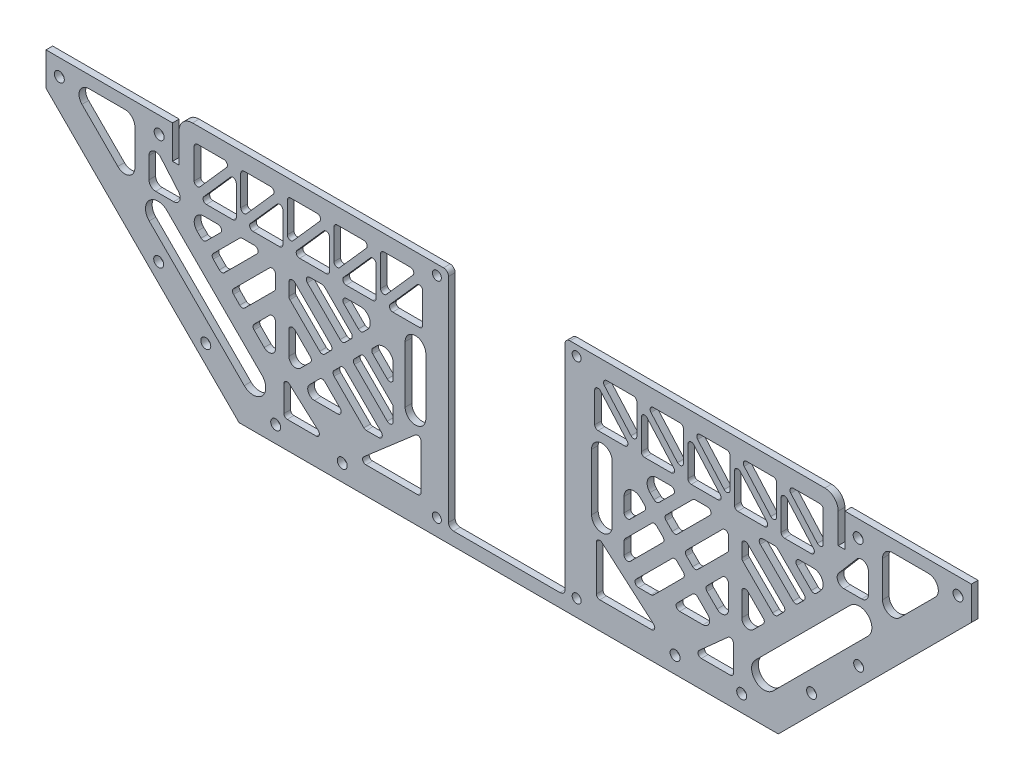
from build123d import *

# Parameters (mm, degrees)
SKETCH_1_R          = 1.5
EXTRUDE_1_DEPTH     = 2
SKETCH_2_R          = 1.5
CUT_EXTRUDE_1_DEPTH = 151.628682528
SKETCH_3_W          = 278
SKETCH_3_H          = 20
CUT_EXTRUDE_2_DEPTH = 151.628682528
EXTRUDE_2_DEPTH     = 2
SKETCH_8_W          = 35
SKETCH_8_H          = 3.344245934
SKETCH_8_R          = 1.35
CUT_EXTRUDE_6_DEPTH = 10
FILLET_2_R          = 1.5
CUT_EXTRUDE_7_DEPTH = 10


with BuildPart() as part:
    # 草图1 → 凸台-拉伸1 (new body)
    with BuildSketch(Plane.XY):
        Polygon((-101, 30), (-101, 0), (101, 0), (101, 30), (139, 30), (139, 0), (81, -58), (-81, -58), (-139, 0), (-139, 30), align=None)
        with Locations((-135, 25)):
            Circle(SKETCH_1_R, mode=Mode.SUBTRACT)
        with Locations((-105, 25)):
            Circle(SKETCH_1_R, mode=Mode.SUBTRACT)
        with Locations((-105, 5)):
            Circle(SKETCH_1_R, mode=Mode.SUBTRACT)
        with Locations((-135, 5)):
            Circle(SKETCH_1_R, mode=Mode.SUBTRACT)
        with Locations(Location((135, 5, 0), (0, 0, 180))):
            Circle(SKETCH_1_R, mode=Mode.SUBTRACT)
        with Locations(Location((105, 5, 0), (0, 0, 180))):
            Circle(SKETCH_1_R, mode=Mode.SUBTRACT)
        with Locations(Location((105, 25, 0), (0, 0, 180))):
            Circle(SKETCH_1_R, mode=Mode.SUBTRACT)
        with Locations(Location((135, 25, 0), (0, 0, 180))):
            Circle(SKETCH_1_R, mode=Mode.SUBTRACT)
        with Locations((-70, -53)):
            Circle(SKETCH_1_R, mode=Mode.SUBTRACT)
        with Locations((-50, -53)):
            Circle(SKETCH_1_R, mode=Mode.SUBTRACT)
        with Locations(Location((50, -53, 0), (0, 0, 180))):
            Circle(SKETCH_1_R, mode=Mode.SUBTRACT)
        with Locations(Location((70, -53, 0), (0, 0, 180))):
            Circle(SKETCH_1_R, mode=Mode.SUBTRACT)
    extrude(amount=EXTRUDE_1_DEPTH)

    # 草图2 → 切除-拉伸1 (cut, through all)
    with BuildSketch(Plane.XY.offset(2)):
        with Locations((-105.142135624, -28.201010127)):
            Circle(SKETCH_2_R)
        with Locations((-91, -42.343145751)):
            Circle(SKETCH_2_R)
        with Locations(Location((91, -42.343145751, 0), (0, 0, 180))):
            Circle(SKETCH_2_R)
        with Locations(Location((105.142135624, -28.201010127, 0), (0, 0, 180))):
            Circle(SKETCH_2_R)
    extrude(amount=-CUT_EXTRUDE_1_DEPTH, mode=Mode.SUBTRACT)

    # 草图3 → 切除-拉伸2 (cut, through all)
    with BuildSketch(Plane.XY.offset(2)):
        with Locations((0, 20)):
            Rectangle(SKETCH_3_W, SKETCH_3_H)
    extrude(amount=-CUT_EXTRUDE_2_DEPTH, mode=Mode.SUBTRACT)

    # 草图4 → 凸台-拉伸2 (add)
    with BuildSketch(Plane.XY.offset(2)):
        with BuildLine():
            Line((-99, 9), (-99, 0))
            Line((-99, 0), (0, 0))
            Line((0, 0), (0, 13))
            Line((0, 13), (-95, 13))
            ThreePointArc((-95, 13), (-97.828427125, 11.828427125), (-99, 9))
        make_face()
        with BuildLine():
            Line((0, 13), (0, 0))
            Line((0, 0), (99, 0))
            Line((99, 0), (99, 9))
            ThreePointArc((99, 9), (97.828427125, 11.828427125), (95, 13))
            Line((95, 13), (0, 13))
        make_face()
    extrude(amount=-EXTRUDE_2_DEPTH)

    # 草图8 → 切除-拉伸6 (cut)
    with BuildSketch(Plane.XY.offset(2)):
        Polygon((-18.072572425, 12.8), (-18.072572425, -54), (16.927427575, -54), (16.927427575, 12.8), (14.927427575, 12.8), (14.927427575, -43), (13.927427575, -43), (13.927427575, -31), (11.927427575, -31), (11.927427575, -43), (10.927427575, -43), (10.927427575, -31), (8.927427575, -31), (8.927427575, -43), (7.927427575, -43), (7.927427575, 12.8), (5.927427575, 12.8), (5.927427575, -43), (4.927427575, -43), (4.927427575, 12.8), (2.927427575, 12.8), (2.927427575, -43), (1.927427575, -43), (1.927427575, 12.8), (-0.072572425, 12.8), (-0.072572425, -43), (-1.072572425, -43), (-1.072572425, 12.8), (-3.072572425, 12.8), (-3.072572425, -43), (-4.072572425, -43), (-4.072572425, 12.8), (-6.072572425, 12.8), (-6.072572425, -43), (-7.072572425, -43), (-7.072572425, 12.8), (-9.072572425, 12.8), (-9.072572425, -43), (-10.072572425, -43), (-10.072572425, 12.8), (-12.072572425, 12.8), (-12.072572425, -43), (-13.072572425, -43), (-13.072572425, 12.8), (-15.072572425, 12.8), (-15.072572425, -43), (-16.072572425, -43), (-16.072572425, 12.8), align=None)
        Polygon((-18.072572425, 13), (-18.072572425, 12.8), (-16.072572425, 12.8), (-16.072572425, -43), (-15.072572425, -43), (-15.072572425, 12.8), (-13.072572425, 12.8), (-13.072572425, -43), (-12.072572425, -43), (-12.072572425, 12.8), (-10.072572425, 12.8), (-10.072572425, -43), (-9.072572425, -43), (-9.072572425, 12.8), (-7.072572425, 12.8), (-7.072572425, -43), (-6.072572425, -43), (-6.072572425, 12.8), (-4.072572425, 12.8), (-4.072572425, -43), (-3.072572425, -43), (-3.072572425, 12.8), (-1.072572425, 12.8), (-1.072572425, -43), (-0.072572425, -43), (-0.072572425, 12.8), (1.927427575, 12.8), (1.927427575, -43), (2.927427575, -43), (2.927427575, 12.8), (4.927427575, 12.8), (4.927427575, -43), (5.927427575, -43), (5.927427575, 12.8), (7.927427575, 12.8), (7.927427575, -43), (8.927427575, -43), (8.927427575, -31), (10.927427575, -31), (10.927427575, -43), (11.927427575, -43), (11.927427575, -31), (13.927427575, -31), (13.927427575, -43), (14.927427575, -43), (14.927427575, 12.8), (16.927427575, 12.8), (16.927427575, 13), align=None)
        with Locations((-0.572572425, 14.672122967)):
            Rectangle(SKETCH_8_W, SKETCH_8_H)
        with Locations((-21.572572425, -53)):
            Circle(SKETCH_8_R)
        with Locations((20.427427575, -53)):
            Circle(SKETCH_8_R)
        with Locations((20.427427575, 10)):
            Circle(SKETCH_8_R)
        with Locations((-21.572572425, 10)):
            Circle(SKETCH_8_R)
    extrude(amount=-CUT_EXTRUDE_6_DEPTH, mode=Mode.SUBTRACT)

    # 圆角2
    fillet_2_edges = [part.edges().sort_by_distance(p)[0] for p in [
        (-18.072572425, 13, 1),
        (16.927427575, 13, 1),
        (16.927427575, -54, 1),
        (-18.072572425, -54, 1),
    ]]
    fillet(fillet_2_edges, radius=FILLET_2_R)

    # 草图9 → 切除-拉伸7 (cut)
    with BuildSketch(Plane.XY.offset(2)):
        with BuildLine():
            Line((-102.65083823, -13.665119092), (-74.087525168, -42.228432153))
            ThreePointArc((-74.087525168, -42.228432153), (-74.087525168, -47.580709932), (-79.439802948, -47.580709932))
            Line((-79.439802948, -47.580709932), (-108.003116009, -19.017396871))
            ThreePointArc((-108.003116009, -19.017396871), (-108.003116009, -13.665119092), (-102.65083823, -13.665119092))
        make_face()
        with BuildLine():
            Line((-80.024639699, -9.549519149), (-76.329598126, -9.549519149))
            ThreePointArc((-76.329598126, -9.549519149), (-75.350738829, -10.20357202), (-75.580411655, -11.358215287))
            Line((-75.580411655, -11.358215287), (-85.414945659, -21.192749291))
            ThreePointArc((-85.414945659, -21.192749291), (-86.164132129, -21.503072488), (-86.9133186, -21.192749291))
            Line((-86.9133186, -21.192749291), (-88.760839387, -19.345228504))
            ThreePointArc((-88.760839387, -19.345228504), (-89.071162584, -18.596042034), (-88.760839387, -17.846855563))
            Line((-88.760839387, -17.846855563), (-80.77382617, -9.859842346))
            ThreePointArc((-80.77382617, -9.859842346), (-80.430096495, -9.63016952), (-80.024639699, -9.549519149))
        make_face()
        with BuildLine():
            Line((-126.080337931, 6.346703076), (-115.30543605, 6.346703076))
            ThreePointArc((-115.30543605, 6.346703076), (-113.184115706, 5.46802342), (-112.30543605, 3.346703076))
            Line((-112.30543605, 3.346703076), (-112.30543605, -7.428198805))
            ThreePointArc((-112.30543605, -7.428198805), (-114.157385753, -10.199837403), (-117.426756393, -9.549519149))
            Line((-117.426756393, -9.549519149), (-128.201658275, 1.225382733))
            ThreePointArc((-128.201658275, 1.225382733), (-128.851976529, 4.494753373), (-126.080337931, 6.346703076))
        make_face()
        with BuildLine():
            Line((-104.540898842, -0.726513749), (-99.159504693, -7.038883921))
            ThreePointArc((-99.159504693, -7.038883921), (-98.865585343, -9.174544011), (-100.681492345, -10.336402163))
            Line((-100.681492345, -10.336402163), (-106.062886494, -10.336402163))
            ThreePointArc((-106.062886494, -10.336402163), (-107.477100056, -9.750615725), (-108.062886494, -8.336402163))
            Line((-108.062886494, -8.336402163), (-108.062886494, -2.024031991))
            ThreePointArc((-108.062886494, -2.024031991), (-106.754270864, -0.147336051), (-104.540898842, -0.726513749))
        make_face()
        with BuildLine():
            Line((-91.583049792, -9.549519149), (-87.328163481, -9.549519149))
            ThreePointArc((-87.328163481, -9.549519149), (-86.349304184, -10.20357202), (-86.57897701, -11.358215287))
            Line((-86.57897701, -11.358215287), (-90.914228336, -15.693466613))
            ThreePointArc((-90.914228336, -15.693466613), (-91.663414807, -16.00378981), (-92.412601278, -15.693466613))
            Line((-92.412601278, -15.693466613), (-93.625540346, -14.480527545))
            ThreePointArc((-93.625540346, -14.480527545), (-94.251692306, -11.332649069), (-91.583049792, -9.549519149))
        make_face()
        with BuildLine():
            Line((-70.033028158, -13.891664048), (-70.033028158, -17.629489916))
            ThreePointArc((-70.033028158, -17.629489916), (-70.113678529, -18.034946713), (-70.343351355, -18.378676387))
            Line((-70.343351355, -18.378676387), (-79.286184959, -27.321509991))
            ThreePointArc((-79.286184959, -27.321509991), (-80.035371429, -27.631833188), (-80.7845579, -27.321509991))
            Line((-80.7845579, -27.321509991), (-82.653470835, -25.452597057))
            ThreePointArc((-82.653470835, -25.452597057), (-82.963794032, -24.703410586), (-82.653470835, -23.954224115))
            Line((-82.653470835, -23.954224115), (-71.841724296, -13.142477577))
            ThreePointArc((-71.841724296, -13.142477577), (-70.687081029, -12.912804751), (-70.033028158, -13.891664048))
        make_face()
        with BuildLine():
            Line((-73.44724172, -34.658826171), (-76.483635963, -31.622431928))
            ThreePointArc((-76.483635963, -31.622431928), (-76.79395916, -30.873245457), (-76.483635963, -30.124058987))
            Line((-76.483635963, -30.124058987), (-71.841724296, -25.48214732))
            ThreePointArc((-71.841724296, -25.48214732), (-70.687081029, -25.252474494), (-70.033028158, -26.231333791))
            Line((-70.033028158, -26.231333791), (-70.033028158, -33.244612608))
            ThreePointArc((-70.033028158, -33.244612608), (-71.267661293, -35.092371673), (-73.44724172, -34.658826171))
        make_face()
        with BuildLine():
            Line((-43.653455038, -15.693466613), (-42.44051597, -14.480527545))
            ThreePointArc((-42.44051597, -14.480527545), (-41.81436401, -11.332649069), (-44.483006524, -9.549519149))
            Line((-44.483006524, -9.549519149), (-48.737892835, -9.549519149))
            ThreePointArc((-48.737892835, -9.549519149), (-49.716752132, -10.20357202), (-49.487079306, -11.358215287))
            Line((-49.487079306, -11.358215287), (-45.15182798, -15.693466613))
            ThreePointArc((-45.15182798, -15.693466613), (-44.402641509, -16.00378981), (-43.653455038, -15.693466613))
        make_face()
        with BuildLine():
            Line((-56.041416617, -9.549519149), (-59.736458191, -9.549519149))
            ThreePointArc((-59.736458191, -9.549519149), (-60.715317487, -10.20357202), (-60.485644661, -11.358215287))
            Line((-60.485644661, -11.358215287), (-50.651110657, -21.192749291))
            ThreePointArc((-50.651110657, -21.192749291), (-49.901924187, -21.503072488), (-49.152737716, -21.192749291))
            Line((-49.152737716, -21.192749291), (-47.305216929, -19.345228504))
            ThreePointArc((-47.305216929, -19.345228504), (-46.994893732, -18.596042034), (-47.305216929, -17.846855563))
            Line((-47.305216929, -17.846855563), (-55.292230146, -9.859842346))
            ThreePointArc((-55.292230146, -9.859842346), (-55.635959821, -9.63016952), (-56.041416617, -9.549519149))
        make_face()
        with BuildLine():
            Line((-66.033028158, -13.891664048), (-66.033028158, -17.629489916))
            ThreePointArc((-66.033028158, -17.629489916), (-65.952377787, -18.034946713), (-65.722704961, -18.378676387))
            Line((-65.722704961, -18.378676387), (-56.779871357, -27.321509991))
            ThreePointArc((-56.779871357, -27.321509991), (-56.030684887, -27.631833188), (-55.281498416, -27.321509991))
            Line((-55.281498416, -27.321509991), (-53.412585481, -25.452597057))
            ThreePointArc((-53.412585481, -25.452597057), (-53.102262285, -24.703410586), (-53.412585481, -23.954224115))
            Line((-53.412585481, -23.954224115), (-64.22433202, -13.142477577))
            ThreePointArc((-64.22433202, -13.142477577), (-65.378975287, -12.912804751), (-66.033028158, -13.891664048))
        make_face()
        with BuildLine():
            Line((-66.033028158, -26.231333791), (-66.033028158, -33.244612608))
            ThreePointArc((-66.033028158, -33.244612608), (-64.798395023, -35.092371673), (-62.618814596, -34.658826171))
            Line((-62.618814596, -34.658826171), (-59.582420353, -31.622431928))
            ThreePointArc((-59.582420353, -31.622431928), (-59.272097156, -30.873245457), (-59.582420353, -30.124058987))
            Line((-59.582420353, -30.124058987), (-64.22433202, -25.48214732))
            ThreePointArc((-64.22433202, -25.48214732), (-65.378975287, -25.252474494), (-66.033028158, -26.231333791))
        make_face()
        with BuildLine():
            Line((-34.681080449, -19.351445224), (-34.681080449, -23.606331535))
            ThreePointArc((-34.681080449, -23.606331535), (-35.33513332, -24.585190832), (-36.489776587, -24.355518006))
            Line((-36.489776587, -24.355518006), (-40.825027914, -20.02026668))
            ThreePointArc((-40.825027914, -20.02026668), (-41.135351111, -19.271080209), (-40.825027914, -18.521893738))
            Line((-40.825027914, -18.521893738), (-39.612088845, -17.30895467))
            ThreePointArc((-39.612088845, -17.30895467), (-36.464210369, -16.68280271), (-34.681080449, -19.351445224))
        make_face()
        with BuildLine():
            Line((-34.991403646, -30.160668846), (-42.978416863, -22.173655629))
            ThreePointArc((-42.978416863, -22.173655629), (-43.727603334, -21.863332432), (-44.476789804, -22.173655629))
            Line((-44.476789804, -22.173655629), (-46.324310591, -24.021176416))
            ThreePointArc((-46.324310591, -24.021176416), (-46.634633788, -24.770362886), (-46.324310591, -25.519549357))
            Line((-46.324310591, -25.519549357), (-36.489776587, -35.354083361))
            ThreePointArc((-36.489776587, -35.354083361), (-35.33513332, -35.583756187), (-34.681080449, -34.60489689))
            Line((-34.681080449, -34.60489689), (-34.681080449, -30.909855317))
            ThreePointArc((-34.681080449, -30.909855317), (-34.76173082, -30.504398521), (-34.991403646, -30.160668846))
        make_face()
        with BuildLine():
            Line((-38.274038877, -39.092770719), (-49.085785415, -28.281024181))
            ThreePointArc((-49.085785415, -28.281024181), (-49.834971886, -27.970700984), (-50.584158357, -28.281024181))
            Line((-50.584158357, -28.281024181), (-52.453071291, -30.149937116))
            ThreePointArc((-52.453071291, -30.149937116), (-52.763394488, -30.899123586), (-52.453071291, -31.648310057))
            Line((-52.453071291, -31.648310057), (-43.510237687, -40.591143661))
            ThreePointArc((-43.510237687, -40.591143661), (-43.166508013, -40.820816487), (-42.761051217, -40.901466858))
            Line((-42.761051217, -40.901466858), (-39.023225348, -40.901466858))
            ThreePointArc((-39.023225348, -40.901466858), (-38.044366051, -40.247413986), (-38.274038877, -39.092770719))
        make_face()
        with BuildLine():
            Line((-51.362895091, -40.901466858), (-58.376173909, -40.901466858))
            ThreePointArc((-58.376173909, -40.901466858), (-60.223932974, -39.666833723), (-59.790387471, -37.487253295))
            Line((-59.790387471, -37.487253295), (-56.753993228, -34.450859053))
            ThreePointArc((-56.753993228, -34.450859053), (-56.004806757, -34.140535856), (-55.255620287, -34.450859053))
            Line((-55.255620287, -34.450859053), (-50.61370862, -39.092770719))
            ThreePointArc((-50.61370862, -39.092770719), (-50.384035794, -40.247413986), (-51.362895091, -40.901466858))
        make_face()
        with BuildLine():
            Line((-65.861592947, -40.395962414), (-57.202177091, -48.157261304))
            ThreePointArc((-57.202177091, -48.157261304), (-56.93562339, -49.259233215), (-57.869611718, -49.901929699))
            Line((-57.869611718, -49.901929699), (-66.529027574, -49.901929699))
            ThreePointArc((-66.529027574, -49.901929699), (-67.236134355, -49.60903648), (-67.529027574, -48.901929699))
            Line((-67.529027574, -48.901929699), (-67.529027574, -41.14063081))
            ThreePointArc((-67.529027574, -41.14063081), (-66.936805316, -40.22754959), (-65.861592947, -40.395962414))
        make_face()
        with BuildLine():
            Line((-28.001970111, -34.67815885), (-43.54833655, -48.146106612))
            ThreePointArc((-43.54833655, -48.146106612), (-43.830530004, -49.251341285), (-42.893560664, -49.901929699))
            Line((-42.893560664, -49.901929699), (-27.347194225, -49.901929699))
            ThreePointArc((-27.347194225, -49.901929699), (-26.640087444, -49.60903648), (-26.347194225, -48.901929699))
            Line((-26.347194225, -48.901929699), (-26.347194225, -35.433981938))
            ThreePointArc((-26.347194225, -35.433981938), (-26.931728153, -34.524373262), (-28.001970111, -34.67815885))
        make_face()
        with BuildLine():
            Line((-24.898898878, -11.969789348), (-24.898898878, -29.030210652))
            ThreePointArc((-24.898898878, -29.030210652), (-28.001970111, -32.133281886), (-31.105041345, -29.030210652))
            Line((-31.105041345, -29.030210652), (-31.105041345, -11.969789348))
            ThreePointArc((-31.105041345, -11.969789348), (-28.001970111, -8.866718114), (-24.898898878, -11.969789348))
        make_face()
        with BuildLine():
            Line((-94.494779984, 7.187170721), (-94.494779984, -1.851085067))
            ThreePointArc((-94.494779984, -1.851085067), (-93.848913659, -2.786279881), (-92.745601303, -2.513453019))
            Line((-92.745601303, -2.513453019), (-84.754649166, 6.524802769))
            ThreePointArc((-84.754649166, 6.524802769), (-84.592134929, 7.598042993), (-85.503827847, 8.187170721))
            Line((-85.503827847, 8.187170721), (-93.494779984, 8.187170721))
            ThreePointArc((-93.494779984, 8.187170721), (-94.201886765, 7.894277502), (-94.494779984, 7.187170721))
        make_face()
        with BuildLine():
            Line((-90.831025633, -6.126076587), (-82.840073495, -6.126076587))
            ThreePointArc((-82.840073495, -6.126076587), (-82.132966714, -5.833183368), (-81.840073495, -5.126076587))
            Line((-81.840073495, -5.126076587), (-81.840073495, 3.912179201))
            ThreePointArc((-81.840073495, 3.912179201), (-82.485939821, 4.847374015), (-83.589252176, 4.574547154))
            Line((-83.589252176, 4.574547154), (-91.580204313, -4.463708634))
            ThreePointArc((-91.580204313, -4.463708634), (-91.74271855, -5.536948858), (-90.831025633, -6.126076587))
        make_face()
        with BuildLine():
            Line((-80.494779984, 7.187170721), (-80.494779984, -1.851085067))
            ThreePointArc((-80.494779984, -1.851085067), (-79.848913659, -2.786279881), (-78.745601303, -2.513453019))
            Line((-78.745601303, -2.513453019), (-70.754649166, 6.524802769))
            ThreePointArc((-70.754649166, 6.524802769), (-70.592134929, 7.598042993), (-71.503827847, 8.187170721))
            Line((-71.503827847, 8.187170721), (-79.494779984, 8.187170721))
            ThreePointArc((-79.494779984, 8.187170721), (-80.201886765, 7.894277502), (-80.494779984, 7.187170721))
        make_face()
        with BuildLine():
            Line((-76.831025633, -6.126076587), (-68.840073495, -6.126076587))
            ThreePointArc((-68.840073495, -6.126076587), (-68.132966714, -5.833183368), (-67.840073495, -5.126076587))
            Line((-67.840073495, -5.126076587), (-67.840073495, 3.912179201))
            ThreePointArc((-67.840073495, 3.912179201), (-68.485939821, 4.847374015), (-69.589252176, 4.574547154))
            Line((-69.589252176, 4.574547154), (-77.580204313, -4.463708634))
            ThreePointArc((-77.580204313, -4.463708634), (-77.74271855, -5.536948858), (-76.831025633, -6.126076587))
        make_face()
        with BuildLine():
            Line((-66.494779984, 7.187170721), (-66.494779984, -1.851085067))
            ThreePointArc((-66.494779984, -1.851085067), (-65.848913659, -2.786279881), (-64.745601303, -2.513453019))
            Line((-64.745601303, -2.513453019), (-56.754649166, 6.524802769))
            ThreePointArc((-56.754649166, 6.524802769), (-56.592134929, 7.598042993), (-57.503827847, 8.187170721))
            Line((-57.503827847, 8.187170721), (-65.494779984, 8.187170721))
            ThreePointArc((-65.494779984, 8.187170721), (-66.201886765, 7.894277502), (-66.494779984, 7.187170721))
        make_face()
        with BuildLine():
            Line((-62.831025633, -6.126076587), (-54.840073495, -6.126076587))
            ThreePointArc((-54.840073495, -6.126076587), (-54.132966714, -5.833183368), (-53.840073495, -5.126076587))
            Line((-53.840073495, -5.126076587), (-53.840073495, 3.912179201))
            ThreePointArc((-53.840073495, 3.912179201), (-54.485939821, 4.847374015), (-55.589252176, 4.574547154))
            Line((-55.589252176, 4.574547154), (-63.580204313, -4.463708634))
            ThreePointArc((-63.580204313, -4.463708634), (-63.74271855, -5.536948858), (-62.831025633, -6.126076587))
        make_face()
        with BuildLine():
            Line((-52.494779984, 7.187170721), (-52.494779984, -1.851085067))
            ThreePointArc((-52.494779984, -1.851085067), (-51.848913659, -2.786279881), (-50.745601303, -2.513453019))
            Line((-50.745601303, -2.513453019), (-42.754649166, 6.524802769))
            ThreePointArc((-42.754649166, 6.524802769), (-42.592134929, 7.598042993), (-43.503827847, 8.187170721))
            Line((-43.503827847, 8.187170721), (-51.494779984, 8.187170721))
            ThreePointArc((-51.494779984, 8.187170721), (-52.201886765, 7.894277502), (-52.494779984, 7.187170721))
        make_face()
        with BuildLine():
            Line((-48.831025633, -6.126076587), (-40.840073495, -6.126076587))
            ThreePointArc((-40.840073495, -6.126076587), (-40.132966714, -5.833183368), (-39.840073495, -5.126076587))
            Line((-39.840073495, -5.126076587), (-39.840073495, 3.912179201))
            ThreePointArc((-39.840073495, 3.912179201), (-40.485939821, 4.847374015), (-41.589252176, 4.574547154))
            Line((-41.589252176, 4.574547154), (-49.580204313, -4.463708634))
            ThreePointArc((-49.580204313, -4.463708634), (-49.74271855, -5.536948858), (-48.831025633, -6.126076587))
        make_face()
        with BuildLine():
            Line((-38.494779984, 7.187170721), (-38.494779984, -1.851085067))
            ThreePointArc((-38.494779984, -1.851085067), (-37.848913659, -2.786279881), (-36.745601303, -2.513453019))
            Line((-36.745601303, -2.513453019), (-28.754649166, 6.524802769))
            ThreePointArc((-28.754649166, 6.524802769), (-28.592134929, 7.598042993), (-29.503827847, 8.187170721))
            Line((-29.503827847, 8.187170721), (-37.494779984, 8.187170721))
            ThreePointArc((-37.494779984, 8.187170721), (-38.201886765, 7.894277502), (-38.494779984, 7.187170721))
        make_face()
        with BuildLine():
            Line((-34.831025633, -6.126076587), (-26.840073495, -6.126076587))
            ThreePointArc((-26.840073495, -6.126076587), (-26.132966714, -5.833183368), (-25.840073495, -5.126076587))
            Line((-25.840073495, -5.126076587), (-25.840073495, 3.912179201))
            ThreePointArc((-25.840073495, 3.912179201), (-26.485939821, 4.847374015), (-27.589252176, 4.574547154))
            Line((-27.589252176, 4.574547154), (-35.580204313, -4.463708634))
            ThreePointArc((-35.580204313, -4.463708634), (-35.74271855, -5.536948858), (-34.831025633, -6.126076587))
        make_face()
    cut_extrude_7 = extrude(amount=-CUT_EXTRUDE_7_DEPTH, mode=Mode.SUBTRACT)

    # 镜向1: 切除-拉伸7 across plane
    add(cut_extrude_7.mirror(Plane(origin=(0, 0, 0), x_dir=(0, 0, 1), z_dir=(1, 0, 0))), mode=Mode.SUBTRACT)


solid = part.part
